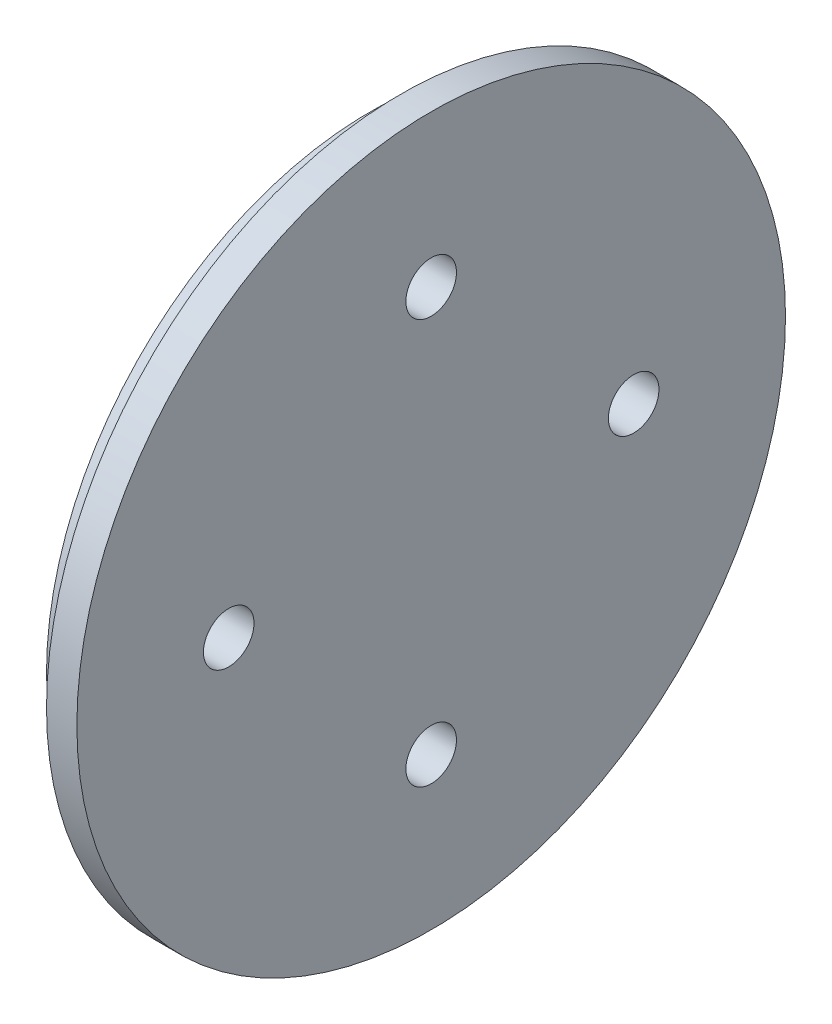
from build123d import *

# Parameters (mm, degrees)
SKETCH_2_R               = 2.5
CUT_EXTRUDE_1_DEPTH      = 33.3
PATTERN_CIRCULAR_1_COUNT = 4


with BuildPart() as part:
    # Эскиз1 → Повернуть1 (revolve)
    with BuildSketch(Plane.XY, mode=Mode.PRIVATE) as revolve_1_sk:
        Polygon((6, 0), (6, 35), (3, 35), (3, 32), (0, 32), (0, 15), (2, 15), (2, 0), align=None)
    revolve(revolve_1_sk.sketch.rotate(Axis((0, 0, 0), (1, 0, 0)), 90), axis=Axis((0, 0, 0), (1, 0, 0)))

    # Эскиз2 → Вырез-Вытянуть1 (cut)
    with BuildSketch(Plane.ZY):
        with Locations((0, 20)):
            Circle(SKETCH_2_R)
    cut_extrude_1 = extrude(amount=-CUT_EXTRUDE_1_DEPTH, mode=Mode.SUBTRACT)

    # Круговой массив1: Вырез-Вытянуть1 ×4 about axis
    pattern_circular_1_axis = Axis((0, 0, 0), (1, 0, 0))
    for i in range(1, PATTERN_CIRCULAR_1_COUNT):
        add(cut_extrude_1.rotate(pattern_circular_1_axis, i * 360 / PATTERN_CIRCULAR_1_COUNT), mode=Mode.SUBTRACT)


solid = part.part
